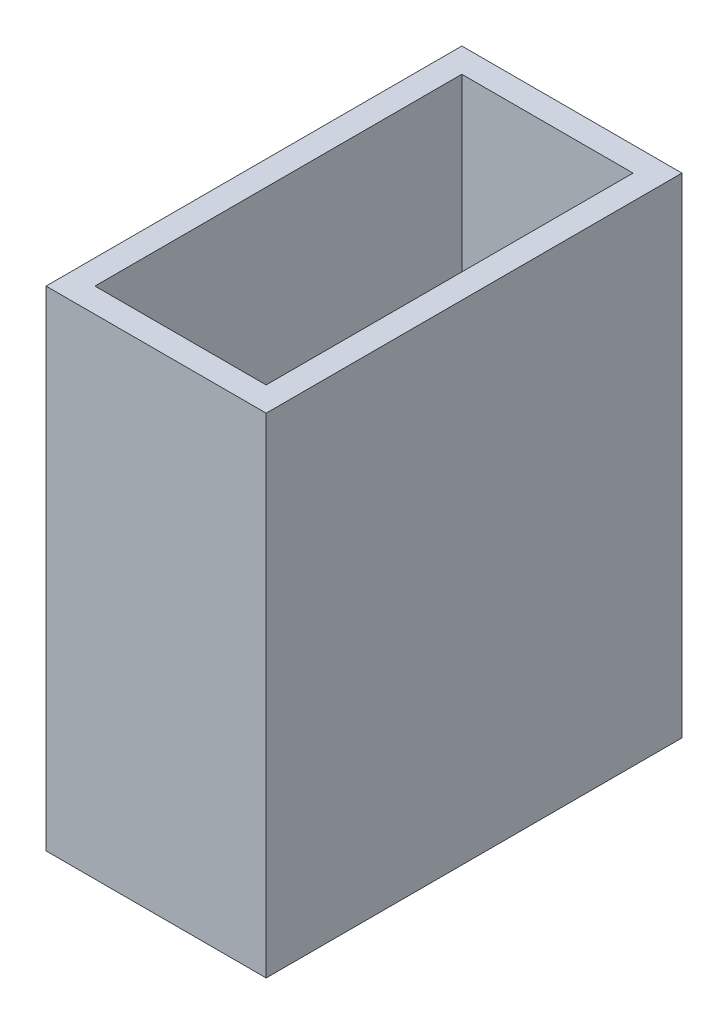
from build123d import *

# Parameters (mm, degrees)
SKETCH1_W           = 45
SKETCH1_H           = 85
BOSS_EXTRUDE1_DEPTH = 100
SHELL1_T            = -5
SKETCH2_W           = 3
SKETCH2_H           = 10
BOSS_EXTRUDE2_DEPTH = 15
SKETCH4_W           = 20
SKETCH4_H           = 2.5
BOSS_EXTRUDE3_DEPTH = 1
SKETCH5_W           = 15.809094042
SKETCH5_H           = 2
BOSS_EXTRUDE4_DEPTH = 1
SKETCH6_W           = 10
SKETCH6_H           = 2.5
BOSS_EXTRUDE5_DEPTH = 1
SKETCH9_W           = 10.477527882
SKETCH9_H           = 6.322646136
CUT_EXTRUDE1_DEPTH  = 9


with BuildPart() as part:
    # Sketch1 → Boss-Extrude1 (new body)
    with BuildSketch(Plane(origin=(0, 0, 0), x_dir=(1, 0, 0), z_dir=(0, 1, 0))):
        Rectangle(SKETCH1_W, SKETCH1_H)
    extrude(amount=BOSS_EXTRUDE1_DEPTH)

    # Shell1
    shell1_openings = [part.faces().sort_by_distance(p)[0] for p in [
        (0, 100, 0),
    ]]
    offset(amount=SHELL1_T, openings=shell1_openings, kind=Kind.INTERSECTION)

    # Sketch2 → Boss-Extrude2 (add)
    with BuildSketch(Plane(origin=(0, 5, 0), x_dir=(1, 0, 0), z_dir=(0, 1, 0))):
        with BuildLine():
            Line((-13.25, -29), (-13.25, -24))
            Line((-13.25, -24), (-16.25, -24))
            Line((-16.25, -24), (-16.25, -32))
            Line((-16.25, -32), (1.75, -32))
            Line((1.75, -32), (1.75, -16.155494421))
            ThreePointArc((1.75, -16.155494421), (0.251072202, -16.248060277), (-1.25, -16.201851746))
            Line((-1.25, -16.201851746), (-1.25, -29))
            Line((-1.25, -29), (-13.25, -29))
        make_face()
        with Locations((-14.75, -19)):
            Rectangle(SKETCH2_W, SKETCH2_H)
        with BuildLine():
            Line((-16.25, -14), (-13.25, -14))
            Line((-13.25, -14), (-13.25, -9.407443861))
            ThreePointArc((-13.25, -9.407443861), (-15.481844205, -4.937104415), (-16.25, 0))
            Line((-16.25, 0), (-16.25, -14))
        make_face()
        with BuildLine():
            Line((-4.205809483, 15.696294677), (-3.429352348, 12.798517198))
            ThreePointArc((-3.429352348, 12.798517198), (0, 13.25), (3.429352348, 12.798517198))
            Line((3.429352348, 12.798517198), (4.205809483, 15.696294677))
            ThreePointArc((4.205809483, 15.696294677), (0, 16.25), (-4.205809483, 15.696294677))
        make_face()
        with BuildLine():
            ThreePointArc((-16.25, 0), (-15.481844205, -4.937104415), (-13.25, -9.407443861))
            Line((-13.25, -9.407443861), (-13.25, 0))
            Line((-13.25, 0), (-16.25, 0))
        make_face()
        with BuildLine():
            Line((-1.25, -13.190905958), (-1.25, -16.201851746))
            ThreePointArc((-1.25, -16.201851746), (0.251072202, -16.248060277), (1.75, -16.155494421))
            Line((1.75, -16.155494421), (1.75, -13.133925537))
            ThreePointArc((1.75, -13.133925537), (0.251618147, -13.247610664), (-1.25, -13.190905958))
        make_face()
    extrude(amount=BOSS_EXTRUDE2_DEPTH)

    # Sketch4 → Boss-Extrude3 (add)
    with BuildSketch(Plane(origin=(-13.25, 0, 0), x_dir=(0, 0, -1), z_dir=(1, 0, 0))):
        with Locations((-19, 18.75)):
            Rectangle(SKETCH4_W, SKETCH4_H)
    extrude(amount=BOSS_EXTRUDE3_DEPTH)

    # Sketch5 → Boss-Extrude4 (add)
    with BuildSketch(Plane.ZY.offset(1.25)):
        with Locations((21.095452979, 19)):
            Rectangle(SKETCH5_W, SKETCH5_H)
    extrude(amount=BOSS_EXTRUDE4_DEPTH)

    # Sketch6 → Boss-Extrude5 (add)
    with BuildSketch(Plane(origin=(0, 0, 29), x_dir=(-1, 0, 0), z_dir=(0, 0, -1))):
        with Locations((7.25, 18.75)):
            Rectangle(SKETCH6_W, SKETCH6_H)
    extrude(amount=BOSS_EXTRUDE5_DEPTH)

    # Sketch9 → Cut-Extrude1 (cut)
    with BuildSketch(Plane(origin=(0, 20, 0), x_dir=(1, 0, 0), z_dir=(0, 1, 0))):
        with Locations((0.163497959, 14.216347227)):
            Rectangle(SKETCH9_W, SKETCH9_H)
    extrude(amount=-CUT_EXTRUDE1_DEPTH, mode=Mode.SUBTRACT)


solid = part.part
